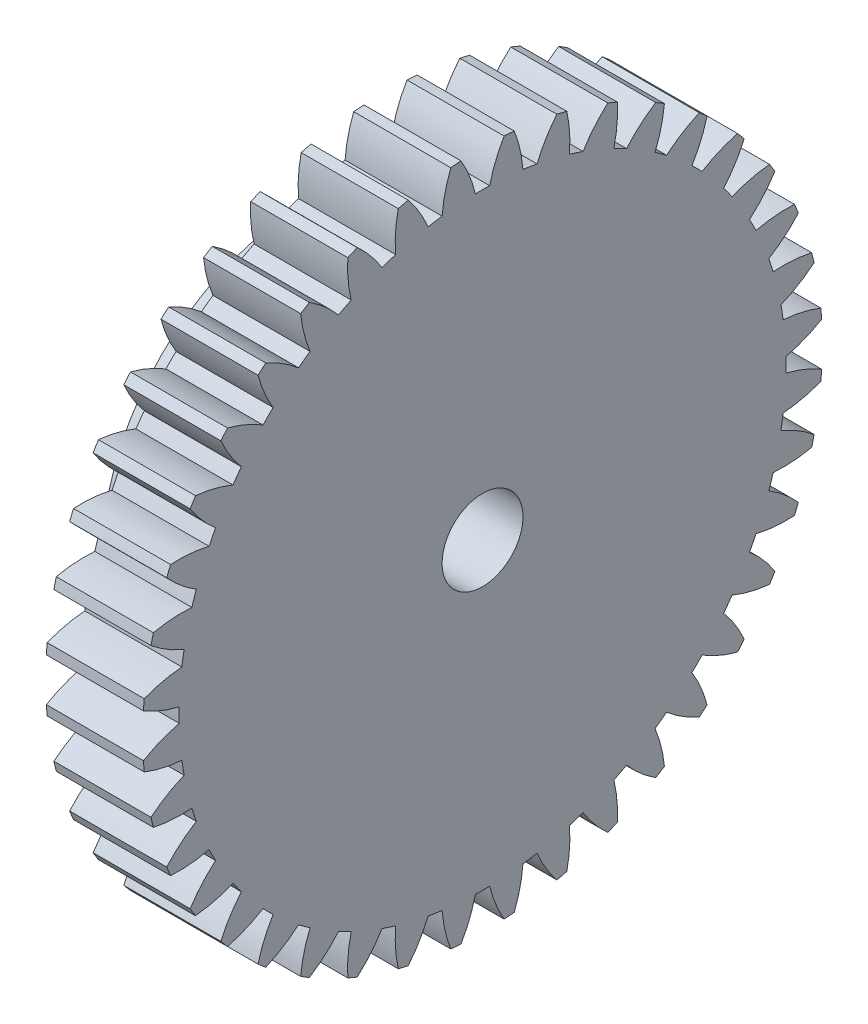
from build123d import *

# Parameters (mm, degrees)
BASPROSKE_W         = 12
BASPROSKE_H         = 42
TOOTHCUT_DEPTH      = 61.59702963
TEETHCUTS_COUNT     = 40
TEETHCUTS_ANGLE     = 351
BORSKE_R            = 5
BORE_DEPTH          = 50.0000508
SKETCH1_R           = 25
SKETCH1_R_2         = 5
SKETCH1_R_3         = 3
BOSS_EXTRUDE1_DEPTH = 10


with BuildPart() as part:
    # BasProSke → Base-Revolve (revolve)
    with BuildSketch(Plane(origin=(0, 0, 0), x_dir=(1, 0, 0), z_dir=(0, 1, 0)), mode=Mode.PRIVATE) as base_revolve_sk:
        with Locations((6, 21)):
            Rectangle(BASPROSKE_W, BASPROSKE_H)
    revolve(base_revolve_sk.sketch.rotate(Axis((-10, 0, 0), (1, 0, 0)), 180), axis=Axis((-10, 0, 0), (1, 0, 0)))

    # TooCutSke → ToothCut (cut, through all)
    with BuildSketch(Plane(origin=(0, 0, 0), x_dir=(0, 0, -1), z_dir=(1, 0, 0))):
        with BuildLine():
            ThreePointArc((0.882812088, 37.488606854), (0, 37.499), (-0.882812088, 37.488606854))
            ThreePointArc((-0.882812088, 37.488606854), (-1.612748684, 39.782000434), (-2.678427154, 41.939960338))
            ThreePointArc((-2.678427154, 41.939960338), (0, 42.0254), (2.678427154, 41.939960338))
            ThreePointArc((2.678427154, 41.939960338), (1.612748684, 39.782000434), (0.882812088, 37.488606854))
        make_face()
    toothcut = extrude(amount=TOOTHCUT_DEPTH, mode=Mode.SUBTRACT)

    # TeethCuts: ToothCut ×40 about axis
    teethcuts_axis = Axis((-10, 0, 0), (1, 0, 0))
    for i in range(1, TEETHCUTS_COUNT):
        add(toothcut.rotate(teethcuts_axis, i * TEETHCUTS_ANGLE / (TEETHCUTS_COUNT - 1)), mode=Mode.SUBTRACT)

    # BorSke → Bore (cut, symmetric)
    with BuildSketch(Plane(origin=(0, 0, 0), x_dir=(0, 0, -1), z_dir=(1, 0, 0))):
        with Locations(Location((0, 0, 0), (0, 0, 180))):
            Circle(BORSKE_R)
    extrude(amount=BORE_DEPTH, both=True, mode=Mode.SUBTRACT)

    # Sketch1 → Boss-Extrude1 (add)
    with BuildSketch(Plane.ZY):
        with Locations(Location((0, 0, 0), (0, 0, 180))):
            Circle(SKETCH1_R)
        Circle(SKETCH1_R_2, mode=Mode.SUBTRACT)
        with Locations((20, 0)):
            Circle(SKETCH1_R_3, mode=Mode.SUBTRACT)
        with Locations((-20, 0)):
            Circle(SKETCH1_R_3, mode=Mode.SUBTRACT)
    extrude(amount=BOSS_EXTRUDE1_DEPTH)


solid = part.part
